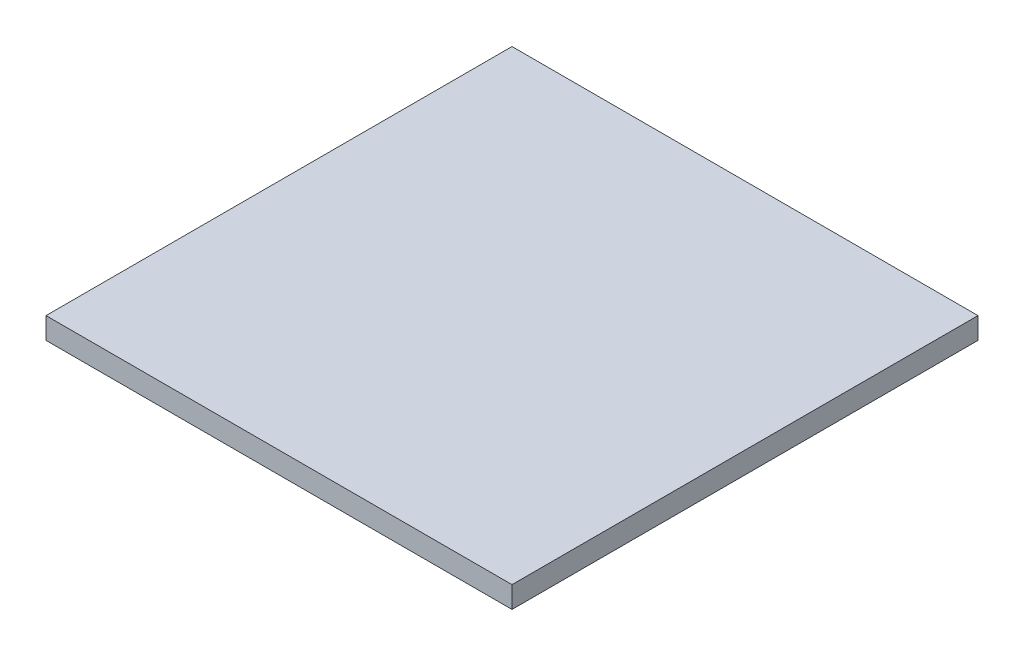
from build123d import *

# Parameters (mm, degrees)
SKETCH_1_W      = 130
SKETCH_1_H      = 130
EXTRUDE_1_DEPTH = 6


with BuildPart() as part:
    # Эскиз1 → Бобышка-Вытянуть1 (new body)
    with BuildSketch(Plane(origin=(0, 0, 0), x_dir=(1, 0, 0), z_dir=(0, 1, 0))):
        Rectangle(SKETCH_1_W, SKETCH_1_H)
    extrude(amount=EXTRUDE_1_DEPTH)


solid = part.part
